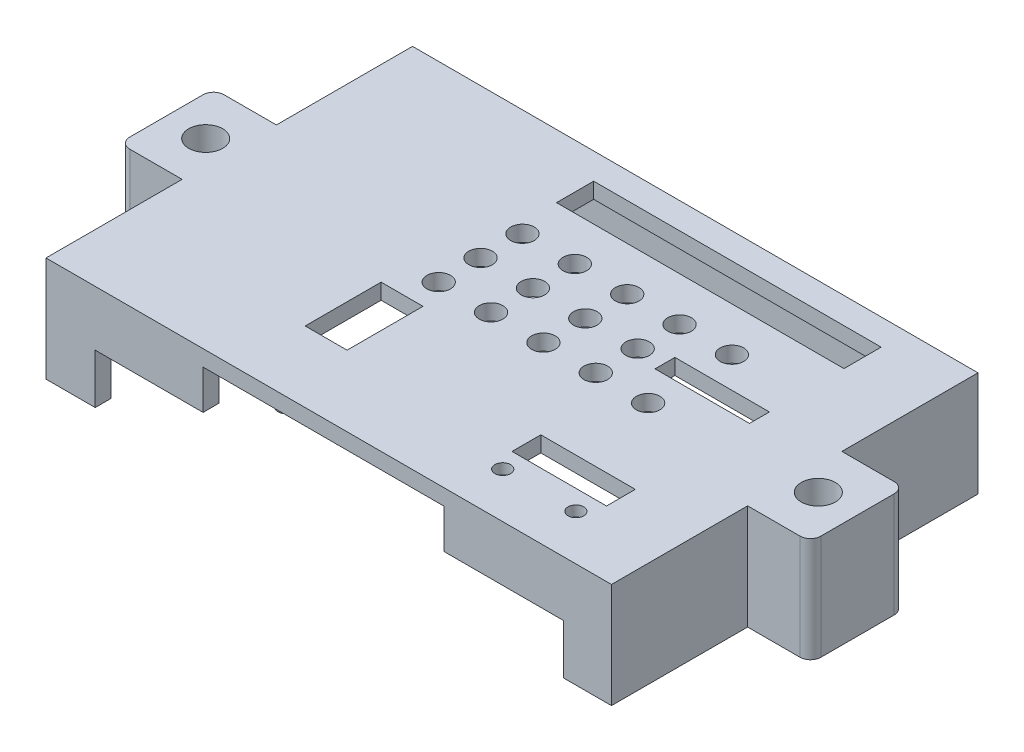
from build123d import *

# Parameters (mm, degrees)
SKETCH2_W           = 108
SKETCH2_H           = 70
SKETCH2_R           = 2.25
SKETCH2_W_2         = 8
SKETCH2_H_2         = 14.5
BOSS_EXTRUDE1_DEPTH = 3
SKETCH5_R           = 3.5635
SKETCH5_R_2         = 1.6865
BOSS_EXTRUDE2_DEPTH = 17
SKETCH6_R           = 1.6865
BOSS_EXTRUDE3_DEPTH = 20.6
SKETCH7_W           = 108
SKETCH7_H           = 70
SKETCH7_W_2         = 102
SKETCH7_H_2         = 64
BOSS_EXTRUDE4_DEPTH = 17.05
SKETCH8_W           = 89.4
SKETCH8_H           = 3
CUT_EXTRUDE1_DEPTH  = 9.5
SKETCH9_W           = 46
SKETCH9_H           = 3
CUT_EXTRUDE2_DEPTH  = 17
SKETCH10_W          = 54.9
SKETCH10_H          = 7.1
CUT_EXTRUDE3_DEPTH  = 78.578234855
SKETCH11_R          = 3.496784868
CUT_EXTRUDE4_DEPTH  = 115.723751218
CUT_EXTRUDE5_START  = -1
SKETCH12_W          = 14.400869084
SKETCH12_H          = 17.05
SKETCH12_R          = 3.496784868
CUT_EXTRUDE5_DEPTH  = 1
SKETCH14_R          = 1.5
SKETCH14_W          = 18.05
SKETCH14_H          = 3.8
SKETCH14_H_2        = 5.5
CUT_EXTRUDE7_DEPTH  = 78.578234855
SKETCH15_R          = 2.5
CUT_EXTRUDE10_DEPTH = 1
SKETCH17_W          = 12
SKETCH17_H          = 18
SKETCH17_R          = 3.25
BOSS_EXTRUDE5_DEPTH = 20.05
FILLET1_R           = 2


with BuildPart() as part:
    # Sketch2 → Boss-Extrude1 (new body)
    # profile 1 of 2: a face of its own
    with BuildSketch(Plane(origin=(0, 0, 0), x_dir=(1, 0, 0), z_dir=(0, 1, 0))):
        with Locations((-7.231065886, 6.378485879)):
            Rectangle(SKETCH2_W, SKETCH2_H)
        with Locations(Location((-19.731065886, 20.878485879, 0), (0, 0, 270))):
            Circle(SKETCH2_R, mode=Mode.SUBTRACT)
        with Locations(Location((-19.731065886, 12.878485879, 0), (0, 0, 270))):
            Circle(SKETCH2_R, mode=Mode.SUBTRACT)
        with Locations(Location((-19.731065886, 4.878485879, 0), (0, 0, 270))):
            Circle(SKETCH2_R, mode=Mode.SUBTRACT)
        with Locations(Location((-9.731065886, 20.878485879, 0), (0, 0, 270))):
            Circle(SKETCH2_R, mode=Mode.SUBTRACT)
        with Locations(Location((-9.731065886, 12.878485879, 0), (0, 0, 270))):
            Circle(SKETCH2_R, mode=Mode.SUBTRACT)
        with Locations(Location((-9.731065886, 4.878485879, 0), (0, 0, 270))):
            Circle(SKETCH2_R, mode=Mode.SUBTRACT)
        with Locations(Location((20.268934114, 20.878485879, 0), (0, 0, 270))):
            Circle(SKETCH2_R, mode=Mode.SUBTRACT)
        with Locations((20.268934114, 12.878485879)):
            Circle(SKETCH2_R, mode=Mode.SUBTRACT)
        with Locations(Location((0.268934114, 20.878485879, 0), (0, 0, 270))):
            Circle(SKETCH2_R, mode=Mode.SUBTRACT)
        with Locations(Location((10.268934114, 20.878485879, 0), (0, 0, 270))):
            Circle(SKETCH2_R, mode=Mode.SUBTRACT)
        with Locations(Location((0.268934114, 12.878485879, 0), (0, 0, 270))):
            Circle(SKETCH2_R, mode=Mode.SUBTRACT)
        with Locations(Location((10.268934114, 12.878485879, 0), (0, 0, 270))):
            Circle(SKETCH2_R, mode=Mode.SUBTRACT)
        with Locations(Location((0.268934114, 4.878485879, 0), (0, 0, 270))):
            Circle(SKETCH2_R, mode=Mode.SUBTRACT)
        with Locations(Location((10.268934114, 4.878485879, 0), (0, 0, 270))):
            Circle(SKETCH2_R, mode=Mode.SUBTRACT)
        with Locations(Location((20.268934114, 4.878485879, 0), (0, 0, 270))):
            Circle(SKETCH2_R, mode=Mode.SUBTRACT)
        with Locations((-21.231065886, -7.871514121)):
            Rectangle(SKETCH2_W_2, SKETCH2_H_2, mode=Mode.SUBTRACT)
    # profile 2 of 2: a face of its own
    with BuildSketch(Plane(origin=(0, 0, 0), x_dir=(1, 0, 0), z_dir=(0, 1, 0))):
        with Locations((20.268934114, 12.878485879)):
            Circle(SKETCH2_R)
    extrude(amount=BOSS_EXTRUDE1_DEPTH)

    # Sketch5 → Boss-Extrude2 (add)
    # profile 1 of 4: a face of its own
    with BuildSketch(Plane(origin=(0, 0, 0), x_dir=(-1, 0, 0), z_dir=(0, -1, 0))):
        with Locations(Location((37.231065886, 32.378485879, 0), (0, 0, 270))):
            Circle(SKETCH5_R)
        with Locations(Location((37.231065886, 32.378485879, 0), (0, 0, 90))):
            Circle(SKETCH5_R_2, mode=Mode.SUBTRACT)
    # profile 2 of 4: a face of its own
    with BuildSketch(Plane(origin=(0, 0, 0), x_dir=(-1, 0, 0), z_dir=(0, -1, 0))):
        with Locations(Location((-37.768934114, 32.378485879, 0), (0, 0, 270))):
            Circle(SKETCH5_R)
        with Locations(Location((-37.768934114, 32.378485879, 0), (0, 0, 90))):
            Circle(SKETCH5_R_2, mode=Mode.SUBTRACT)
    # profile 3 of 4: a face of its own
    with BuildSketch(Plane(origin=(0, 0, 0), x_dir=(-1, 0, 0), z_dir=(0, -1, 0))):
        with Locations(Location((-37.768934114, -6.621514121, 0), (0, 0, 270))):
            Circle(SKETCH5_R)
        with Locations(Location((-37.768934114, -6.621514121, 0), (0, 0, 90))):
            Circle(SKETCH5_R_2, mode=Mode.SUBTRACT)
    # profile 4 of 4: a face of its own
    with BuildSketch(Plane(origin=(0, 0, 0), x_dir=(-1, 0, 0), z_dir=(0, -1, 0))):
        with Locations(Location((37.231065886, -6.621514121, 0), (0, 0, 270))):
            Circle(SKETCH5_R)
        with Locations(Location((37.231065886, -6.621514121, 0), (0, 0, 90))):
            Circle(SKETCH5_R_2, mode=Mode.SUBTRACT)
    extrude(amount=BOSS_EXTRUDE2_DEPTH)

    # Sketch6 → Boss-Extrude3 (add)
    with BuildSketch(Plane(origin=(0, 0, 0), x_dir=(-1, 0, 0), z_dir=(0, -1, 0))):
        with Locations(Location((37.231065886, 32.378485879, 0), (0, 0, 270))):
            Circle(SKETCH6_R)
        with Locations(Location((-37.768934114, 32.378485879, 0), (0, 0, 270))):
            Circle(SKETCH6_R)
        with Locations(Location((-37.768934114, -6.621514121, 0), (0, 0, 270))):
            Circle(SKETCH6_R)
        with Locations(Location((37.231065886, -6.621514121, 0), (0, 0, 270))):
            Circle(SKETCH6_R)
    extrude(amount=BOSS_EXTRUDE3_DEPTH)

    # Sketch7 → Boss-Extrude4 (add)
    with BuildSketch(Plane(origin=(0, 0, 0), x_dir=(-1, 0, 0), z_dir=(0, -1, 0))):
        with Locations((7.231065886, 6.378485879)):
            Rectangle(SKETCH7_W, SKETCH7_H)
        with Locations((7.231065886, 6.378485879)):
            Rectangle(SKETCH7_W_2, SKETCH7_H_2, mode=Mode.SUBTRACT)
    extrude(amount=BOSS_EXTRUDE4_DEPTH)

    # Sketch8 → Cut-Extrude1 (cut)
    with BuildSketch(Plane.XZ.offset(17.05)):
        with Locations((-7.131065886, 27.121514121)):
            Rectangle(SKETCH8_W, SKETCH8_H)
    extrude(amount=-CUT_EXTRUDE1_DEPTH, mode=Mode.SUBTRACT)

    # Sketch9 → Cut-Extrude2 (cut)
    with BuildSketch(Plane.XZ.offset(17.05)):
        with Locations((-8.231065886, 27.121514121)):
            Rectangle(SKETCH9_W, SKETCH9_H)
    extrude(amount=-CUT_EXTRUDE2_DEPTH, mode=Mode.SUBTRACT)

    # Sketch10 → Cut-Extrude3 (cut, through all)
    with BuildSketch(Plane(origin=(0, 3, 0), x_dir=(1, 0, 0), z_dir=(0, 1, 0))):
        with Locations((5.818934114, 32.828485879)):
            Rectangle(SKETCH10_W, SKETCH10_H)
    extrude(amount=-CUT_EXTRUDE3_DEPTH, mode=Mode.SUBTRACT)

    # Sketch11 → Cut-Extrude4 (cut, through all)
    with BuildSketch(Plane(origin=(-58.231065886, 0, 0), x_dir=(0, 0, -1), z_dir=(1, 0, 0))):
        with Locations((-8.621514121, -8.525)):
            Circle(SKETCH11_R)
        with Locations(Location((21.378485879, -8.525, 0), (0, 0, 180))):
            Circle(SKETCH11_R)
    extrude(amount=-CUT_EXTRUDE4_DEPTH, mode=Mode.SUBTRACT)

    # Sketch12 → Cut-Extrude5 (cut)
    # profile 1 of 2: a face of its own
    with BuildSketch(Plane.ZY.offset(61.231065886).offset(CUT_EXTRUDE5_START)):
        with Locations((-22.578920421, -8.525)):
            Rectangle(SKETCH12_W, SKETCH12_H)
        with Locations((-21.378485879, -8.525)):
            Circle(SKETCH12_R, mode=Mode.SUBTRACT)
    # profile 2 of 2: a face of its own
    with BuildSketch(Plane.ZY.offset(61.231065886).offset(CUT_EXTRUDE5_START)):
        with Locations((9.821948663, -8.525)):
            Rectangle(SKETCH12_W, SKETCH12_H)
        with Locations(Location((8.621514121, -8.525, 0), (0, 0, 180))):
            Circle(SKETCH12_R, mode=Mode.SUBTRACT)
    extrude(amount=CUT_EXTRUDE5_DEPTH, mode=Mode.SUBTRACT)

    # Sketch14 → Cut-Extrude7 (cut, through all)
    with BuildSketch(Plane(origin=(0, 3, 0), x_dir=(1, 0, 0), z_dir=(0, 1, 0))):
        with Locations(Location((31.278934114, -19.931514121, 0), (0, 0, 270))):
            Circle(SKETCH14_R)
        with Locations(Location((17.308934114, -19.931514121, 0), (0, 0, 270))):
            Circle(SKETCH14_R)
        with Locations((24.293934114, 13.088485879)):
            Rectangle(SKETCH14_W, SKETCH14_H)
        with Locations((24.293934114, -13.371514121)):
            Rectangle(SKETCH14_W, SKETCH14_H_2)
    extrude(amount=-CUT_EXTRUDE7_DEPTH, mode=Mode.SUBTRACT)

    # Sketch15 → Cut-Extrude10 (cut)
    with BuildSketch(Plane.XZ):
        with Locations(Location((17.308934114, 19.931514121, 0), (0, 0, 270))):
            Circle(SKETCH15_R)
        with Locations(Location((31.278934114, 19.931514121, 0), (0, 0, 270))):
            Circle(SKETCH15_R)
    extrude(amount=-CUT_EXTRUDE10_DEPTH, mode=Mode.SUBTRACT)

    # Sketch17 → Boss-Extrude5 (add)
    # profile 1 of 2: a face of its own
    with BuildSketch(Plane.XZ.offset(17.05)):
        with Locations((-67.231065886, -6.378485879)):
            Rectangle(SKETCH17_W, SKETCH17_H)
        with Locations(Location((-65.731065886, -6.378485879, 0), (0, 0, 270))):
            Circle(SKETCH17_R, mode=Mode.SUBTRACT)
    # profile 2 of 2: a face of its own
    with BuildSketch(Plane.XZ.offset(17.05)):
        with Locations((52.768934114, -6.378485879)):
            Rectangle(SKETCH17_W, SKETCH17_H)
        with Locations(Location((51.268934114, -6.378485879, 0), (0, 0, 270))):
            Circle(SKETCH17_R, mode=Mode.SUBTRACT)
    extrude(amount=-BOSS_EXTRUDE5_DEPTH)

    # Fillet1
    fillet1_edges = [part.edges().sort_by_distance(p)[0] for p in [
        (-73.231065886, -7.025, -15.378485879),
        (-73.231065886, -7.025, 2.621514121),
        (58.768934114, -7.025, -15.378485879),
        (58.768934114, -7.025, 2.621514121),
    ]]
    fillet(fillet1_edges, radius=FILLET1_R)


solid = part.part
